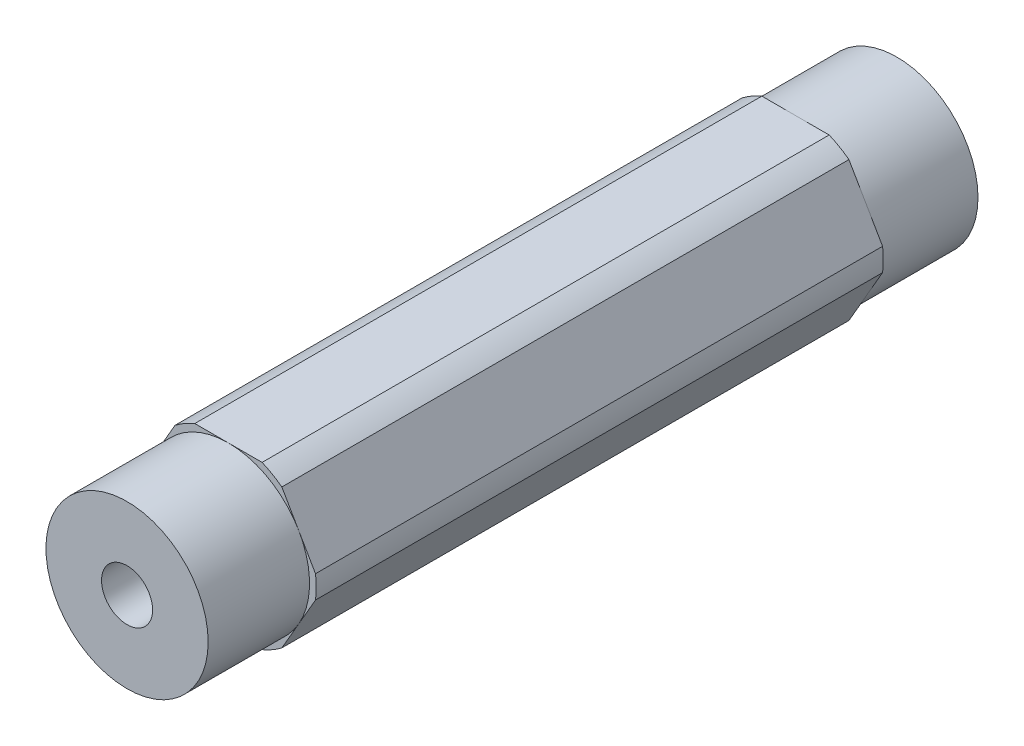
from build123d import *

# Parameters (mm, degrees)
SKETCH1_R           = 2.000000064
BOSS_EXTRUDE1_DEPTH = 22.1996
SKETCH4_R           = 6.35
SKETCH4_R_2         = 2.000000064
BOSS_EXTRUDE2_DEPTH = 7.9375


with BuildPart() as part:
    # Sketch1 → Boss-Extrude1 (new, symmetric)
    with BuildSketch(Plane.XY):
        with BuildLine():
            ThreePointArc((4.181770846, 5.456960429), (3.437499983, 5.953924622), (2.634980936, 6.35))
            Line((2.634980936, 6.35), (-2.634980936, 6.35))
            ThreePointArc((-2.634980936, 6.35), (-3.437499983, 5.953924622), (-4.181770846, 5.456960429))
            Line((-4.181770846, 5.456960429), (-6.816751782, 0.893039571))
            ThreePointArc((-6.816751782, 0.893039571), (-6.874999966, 0), (-6.816751782, -0.893039571))
            Line((-6.816751782, -0.893039571), (-4.181770846, -5.456960429))
            ThreePointArc((-4.181770846, -5.456960429), (-3.437499983, -5.953924622), (-2.634980936, -6.35))
            Line((-2.634980936, -6.35), (2.634980936, -6.35))
            ThreePointArc((2.634980936, -6.35), (3.437499983, -5.953924622), (4.181770846, -5.456960429))
            Line((4.181770846, -5.456960429), (6.816751782, -0.893039571))
            ThreePointArc((6.816751782, -0.893039571), (6.860422465, -0.447468582), (6.874999966, 0))
            ThreePointArc((6.874999966, 0), (6.860422465, 0.447468582), (6.816751782, 0.893039571))
            Line((6.816751782, 0.893039571), (4.181770846, 5.456960429))
        make_face()
        Circle(SKETCH1_R, mode=Mode.SUBTRACT)
    extrude(amount=BOSS_EXTRUDE1_DEPTH, both=True)

    # Sketch4 → Boss-Extrude2 (add)
    with BuildSketch(Plane.XY.offset(22.1996)):
        with Locations(Location((0, 0, 0), (0, 0, 150))):
            Circle(SKETCH4_R)
        Circle(SKETCH4_R_2, mode=Mode.SUBTRACT)
    boss_extrude2 = extrude(amount=BOSS_EXTRUDE2_DEPTH)

    # Mirror1: Boss-Extrude2 across plane
    add(boss_extrude2.mirror(Plane.XY))


solid = part.part
